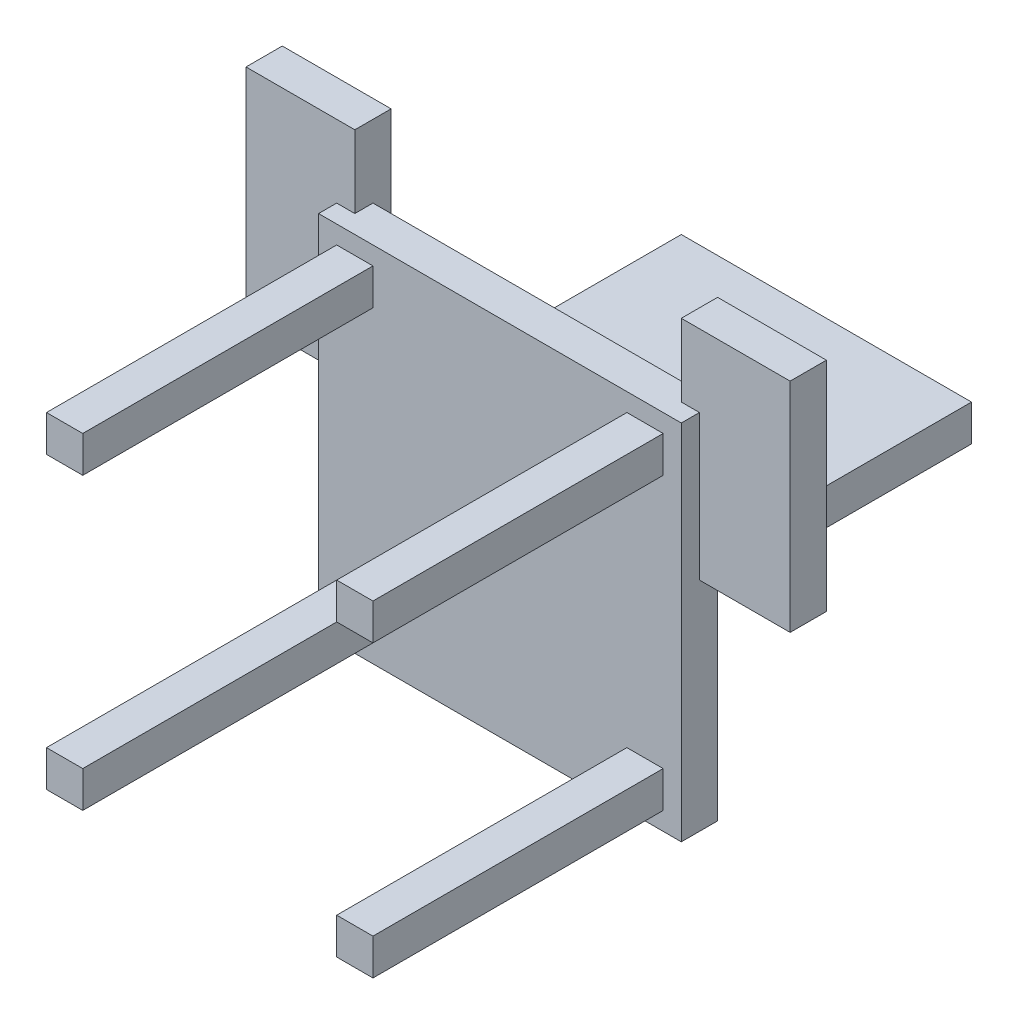
from build123d import *

# Parameters (mm, degrees)
SKETCH_1_W      = 500
SKETCH_1_H      = 500
EXTRUDE_1_DEPTH = 50
SKETCH_2_W      = 50
SKETCH_2_H      = 50
EXTRUDE_2_DEPTH = 450
SKETCH_3_W      = 50
SKETCH_3_H      = 50
EXTRUDE_3_DEPTH = 450
SKETCH_4_W      = 50
SKETCH_4_H      = 50
EXTRUDE_4_DEPTH = 450
SKETCH_5_W      = 50
SKETCH_5_H      = 50
EXTRUDE_5_DEPTH = 450
SKETCH_6_W      = 400
SKETCH_6_H      = 50
EXTRUDE_6_DEPTH = 400
SKETCH_7_W      = 50
SKETCH_7_H      = 300
EXTRUDE_7_DEPTH = 150
SKETCH_8_W      = 50
SKETCH_8_H      = 300
EXTRUDE_8_DEPTH = 150


with BuildPart() as part:
    # 草图1 → 凸台-拉伸1 (new body)
    with BuildSketch(Plane.XY):
        Rectangle(SKETCH_1_W, SKETCH_1_H)
    extrude(amount=EXTRUDE_1_DEPTH)

    # 草图2 → 凸台-拉伸2 (add)
    with BuildSketch(Plane.XY):
        with Locations((-200, -200)):
            Rectangle(SKETCH_2_W, SKETCH_2_H)
    extrude(amount=EXTRUDE_2_DEPTH)

    # 草图3 → 凸台-拉伸3 (add)
    with BuildSketch(Plane.XY):
        with Locations((200, -200)):
            Rectangle(SKETCH_3_W, SKETCH_3_H)
    extrude(amount=EXTRUDE_3_DEPTH)

    # 草图4 → 凸台-拉伸4 (add)
    with BuildSketch(Plane.XY):
        with Locations((-200, 200)):
            Rectangle(SKETCH_4_W, SKETCH_4_H)
    extrude(amount=EXTRUDE_4_DEPTH)

    # 草图5 → 凸台-拉伸5 (add)
    with BuildSketch(Plane.XY):
        with Locations((200, 200)):
            Rectangle(SKETCH_5_W, SKETCH_5_H)
    extrude(amount=EXTRUDE_5_DEPTH)

    # 草图6 → 凸台-拉伸6 (add)
    with BuildSketch(Plane(origin=(0, 0, 0), x_dir=(-1, 0, 0), z_dir=(0, 0, -1))):
        Rectangle(SKETCH_6_W, SKETCH_6_H)
    extrude(amount=EXTRUDE_6_DEPTH)

    # 草图7 → 凸台-拉伸7 (add)
    with BuildSketch(Plane(origin=(225, 0, 0), x_dir=(0, 0, -1), z_dir=(1, 0, 0))):
        with Locations((0, 200)):
            Rectangle(SKETCH_7_W, SKETCH_7_H)
    extrude(amount=EXTRUDE_7_DEPTH)

    # 草图8 → 凸台-拉伸8 (add)
    with BuildSketch(Plane.ZY.offset(225)):
        with Locations((0, 200)):
            Rectangle(SKETCH_8_W, SKETCH_8_H)
    extrude(amount=EXTRUDE_8_DEPTH)


solid = part.part
